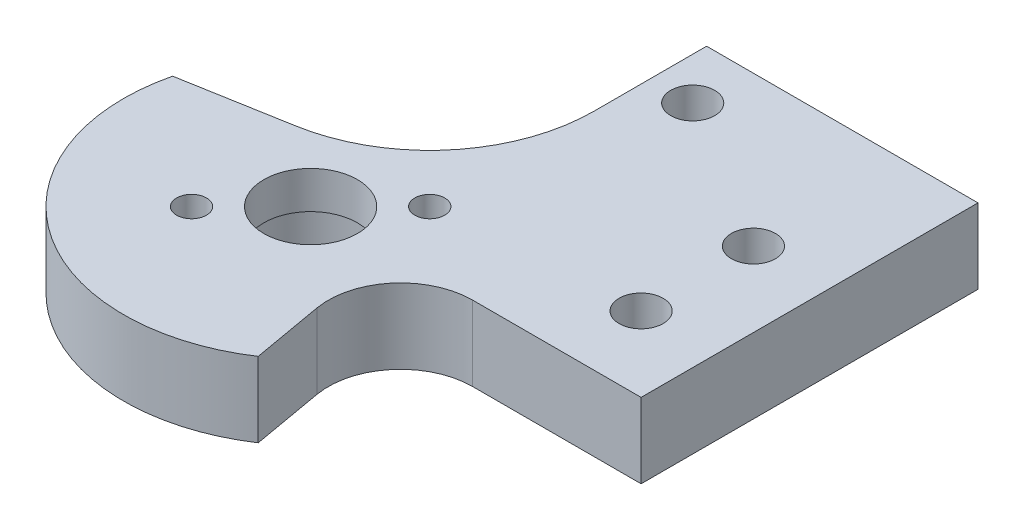
from build123d import *

# Parameters (mm, degrees)
SKETCH_3_R              = 1.175
SKETCH_3_R_2            = 2.5
EXTRUDE_2_DEPTH         = 4
HOLE_WIZARD_1_6_1_6_1_D = 1.6
SKETCH_11_R             = 1.6
CUT_EXTRUDE_1_DEPTH     = 1
SKETCH_12_R             = 3.05
CUT_EXTRUDE_2_DEPTH     = 2


with BuildPart() as part:
    # 草图3 → 凸台-拉伸2 (new body)
    with BuildSketch(Plane(origin=(0, 0, 0), x_dir=(1, 0, 0), z_dir=(0, 1, 0))):
        with BuildLine():
            Line((0, 0), (14.5, 0))
            Line((14.5, 0), (14.5, -6))
            ThreePointArc((14.5, -6), (16.558133666, -11.654675774), (21.769511049, -14.663465909))
            Line((21.769511049, -14.663465909), (27.377359106, -15.652280825))
            ThreePointArc((27.377359106, -15.652280825), (23.392618613, -26.191520443), (12.126111401, -26.331319436))
            Line((12.126111401, -26.331319436), (12.79720876, -22.525337182))
            ThreePointArc((12.79720876, -22.525337182), (11.953704072, -19.377334829), (9, -18))
            Line((9, -18), (0, -18))
            Line((0, -18), (0, 0))
        make_face()
        with Locations(Location((4, -14, 0), (0, 0, 270))):
            Circle(SKETCH_3_R, mode=Mode.SUBTRACT)
        with Locations(Location((4, -8, 0), (0, 0, 270))):
            Circle(SKETCH_3_R, mode=Mode.SUBTRACT)
        with Locations(Location((12.242640687, -3, 0), (0, 0, 270))):
            Circle(SKETCH_3_R, mode=Mode.SUBTRACT)
        with Locations(Location((17.656854249, -18, 0), (0, 0, 270))):
            Circle(SKETCH_3_R_2, mode=Mode.SUBTRACT)
    extrude(amount=EXTRUDE_2_DEPTH)

    # Ø1.6 (1.6) 直径孔1 (through all)
    with Locations(Plane(origin=(0, 4, 0), x_dir=(1, 0, 0), z_dir=(0, 1, 0))):
        with Locations((20.838834765, -21.181980515), (14.474873734, -14.818019485)):
            Hole(HOLE_WIZARD_1_6_1_6_1_D / 2)


with BuildPart() as body_2:
    # 镜向1: mirrored copy
    add(part.part.mirror(Plane(origin=(0, 4, 0), x_dir=(0, 0, 1), z_dir=(1, 0, 0))))

    # 草图11 → 切除-拉伸1 (cut)
    with BuildSketch(Plane(origin=(0, 0, 0), x_dir=(-1, 0, 0), z_dir=(0, -1, 0))):
        with Locations(Location((14.474873734, -14.818019485, 0), (0, 0, 90))):
            Circle(SKETCH_11_R)
        with Locations(Location((20.838834765, -21.181980515, 0), (0, 0, 90))):
            Circle(SKETCH_11_R)
    extrude(amount=-CUT_EXTRUDE_1_DEPTH, mode=Mode.SUBTRACT)

    # 草图12 → 切除-拉伸2 (cut)
    with BuildSketch(Plane(origin=(0, 0, 0), x_dir=(-1, 0, 0), z_dir=(0, -1, 0))):
        with Locations(Location((17.656854249, -18, 0), (0, 0, 90))):
            Circle(SKETCH_12_R)
    extrude(amount=-CUT_EXTRUDE_2_DEPTH, mode=Mode.SUBTRACT)


solid = body_2.part
